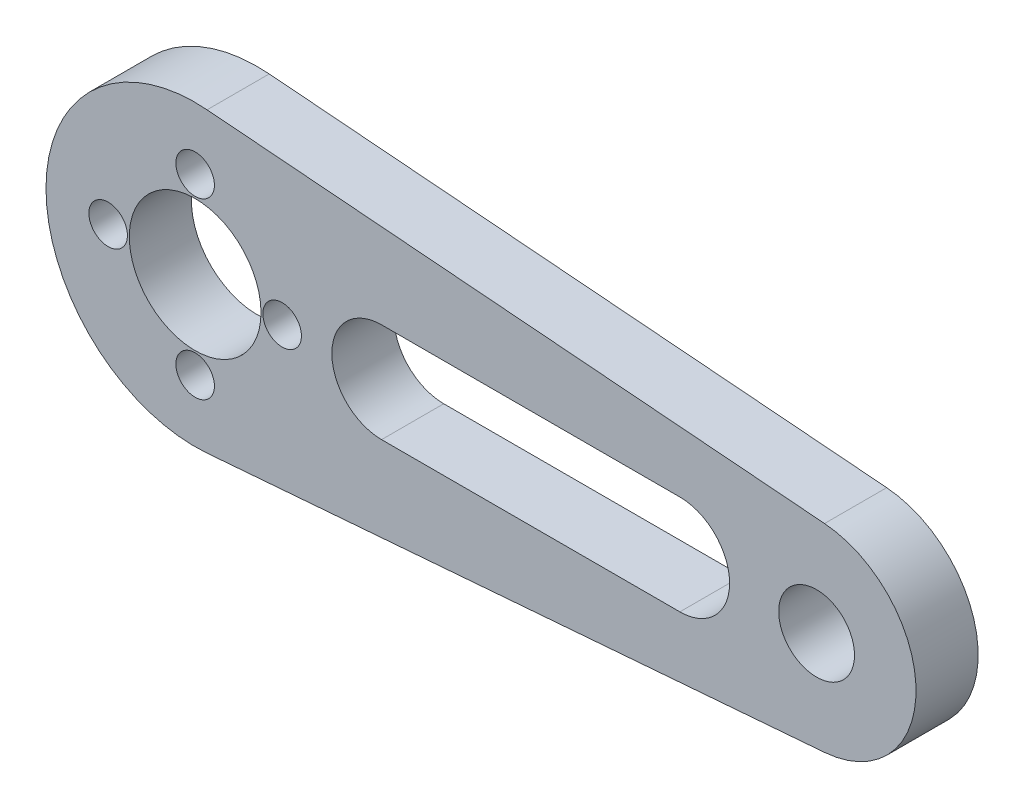
from build123d import *

# Parameters (mm, degrees)
SKETCH_1_R          = 5.3
SKETCH_1_R_2        = 3.05
SKETCH_1_R_3        = 1.55
EXTRUDE_1_DEPTH     = 5
CUT_EXTRUDE_1_DEPTH = 10


with BuildPart() as part:
    # 草图1 → 凸台-拉伸1 (new body)
    with BuildSketch(Plane.XY):
        with BuildLine():
            Line((0.96, 11.961538363), (50.64, 7.974358908))
            ThreePointArc((50.64, 7.974358908), (58, 0), (50.64, -7.974358908))
            Line((50.64, -7.974358908), (0.96, -11.961538363))
            ThreePointArc((0.96, -11.961538363), (-12, 0), (0.96, 11.961538363))
        make_face()
        Circle(SKETCH_1_R, mode=Mode.SUBTRACT)
        with Locations((50, 0)):
            Circle(SKETCH_1_R_2, mode=Mode.SUBTRACT)
        with Locations((-7, 0)):
            Circle(SKETCH_1_R_3, mode=Mode.SUBTRACT)
        with Locations((7, 0)):
            Circle(SKETCH_1_R_3, mode=Mode.SUBTRACT)
        with Locations((0, 7)):
            Circle(SKETCH_1_R_3, mode=Mode.SUBTRACT)
        with Locations((0, -7)):
            Circle(SKETCH_1_R_3, mode=Mode.SUBTRACT)
    extrude(amount=EXTRUDE_1_DEPTH)

    # 草图2 → 切除-拉伸1 (cut)
    with BuildSketch(Plane.XY.offset(5)):
        with BuildLine():
            Line((15, 4), (39, 4))
            ThreePointArc((39, 4), (43, 0), (39, -4))
            Line((39, -4), (15, -4))
            ThreePointArc((15, -4), (11, 0), (15, 4))
        make_face()
    extrude(amount=-CUT_EXTRUDE_1_DEPTH, mode=Mode.SUBTRACT)


solid = part.part
